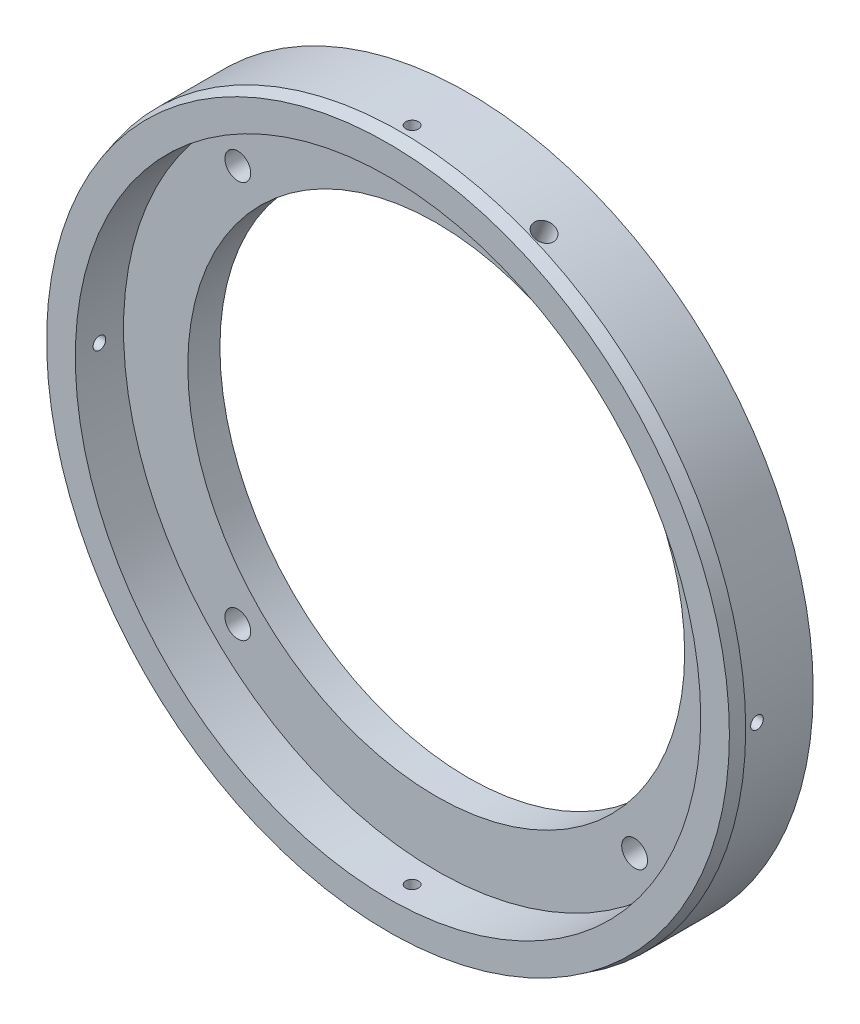
from build123d import *

# Parameters (mm, degrees)
SKETCH1_R                      = 68.1355
SKETCH1_R_2                    = 49.0855
EXTRUDE1_DEPTH                 = 15.875
SKETCH2_R                      = 61.7855
EXTRUDE2_DEPTH                 = 9.525
TAP_DRILL_FOR_10_32_TAP1_D     = 4.0386
TAP_DRILL_FOR_10_32_TAP1_DEPTH = 12.7
TAP_DRILL_FOR_10_32_TAP1_TIP   = 1.213317848
CIRPATTERN1_COUNT              = 4
CIRPATTERN2_COUNT              = 4
CHAMFER1_SIZE                  = 2.54
CHAMFER1_SIZE2                 = 0.680590949


with BuildPart() as part:
    # Sketch1 → Extrude1 (new body)
    with BuildSketch(Plane.XY):
        Circle(SKETCH1_R)
        Circle(SKETCH1_R_2, mode=Mode.SUBTRACT)
    extrude(amount=EXTRUDE1_DEPTH)

    # Sketch2 → Extrude2 (cut)
    with BuildSketch(Plane.XY.offset(15.875)):
        Circle(SKETCH2_R)
    extrude(amount=-EXTRUDE2_DEPTH, mode=Mode.SUBTRACT)

    # Tap Drill for #10-32 Tap1
    with Locations(Plane(origin=(26.074327006, 62.948993887, 11.1125), x_dir=(-0.9238795325112864, 0.38268343236509067, 0), z_dir=(0.38268343236509067, 0.9238795325112864, 0))):
        with Locations((0, 0)):
            Hole(TAP_DRILL_FOR_10_32_TAP1_D / 2, depth=TAP_DRILL_FOR_10_32_TAP1_DEPTH)
            with Locations((0, 0, -(TAP_DRILL_FOR_10_32_TAP1_DEPTH + TAP_DRILL_FOR_10_32_TAP1_TIP / 2))):  # 118° drill point
                Cone(0, TAP_DRILL_FOR_10_32_TAP1_D / 2, TAP_DRILL_FOR_10_32_TAP1_TIP, mode=Mode.SUBTRACT)

    # Sketch4 → M3x0.5 Tapped Hole1 (revolve, cut)
    with BuildSketch(Plane(origin=(0, 68.1355, 11.1125), x_dir=(0, 0, 1), z_dir=(1, 0, 0))):
        Polygon((0, 0), (0, 9.387075774), (1.25, 8.636), (1.25, 0), align=None)
    m3x0_5_tapped_hole1 = revolve(axis=Axis((0, 74.4855, 11.1125), (0, -1, 0)), mode=Mode.SUBTRACT)

    # CirPattern1: M3x0.5 Tapped Hole1 ×4 about axis
    cirpattern1_axis = Axis((0, 0, 15.875), (0, 0, -1))
    for i in range(1, CIRPATTERN1_COUNT):
        add(m3x0_5_tapped_hole1.rotate(cirpattern1_axis, i * 360 / CIRPATTERN1_COUNT), mode=Mode.SUBTRACT)

    # Sketch8 → 1/4-20 Tapped Hole1 (revolve, cut)
    with BuildSketch(Plane(origin=(39.198817968, 39.198817968, 11.1125), x_dir=(0, -1, 0), z_dir=(1, 0, 0))):
        Polygon((0, 0), (0, 18.043816902), (2.5527, 16.51), (2.5527, 0), align=None)
    f_1_4_20_tapped_hole1 = revolve(axis=Axis((39.198817968, 39.198817968, 17.4625), (0, 0, -1)), mode=Mode.SUBTRACT)

    # CirPattern2: 1/4-20 Tapped Hole1 ×4 about axis
    cirpattern2_axis = Axis((0, 0, 0), (0, 0, 1))
    for i in range(1, CIRPATTERN2_COUNT):
        add(f_1_4_20_tapped_hole1.rotate(cirpattern2_axis, i * 360 / CIRPATTERN2_COUNT), mode=Mode.SUBTRACT)

    # Chamfer1
    chamfer1_edges = [part.edges().sort_by_distance(p)[0] for p in [
        (-68.1355, 0, 15.875),
    ]]
    chamfer1_side = [part.faces().sort_by_distance(p)[0] for p in [
        (-68.1355, 0, 7.9375),
    ]]
    chamfer(chamfer1_edges, length=CHAMFER1_SIZE, length2=CHAMFER1_SIZE2, reference=chamfer1_side[0])


solid = part.part
